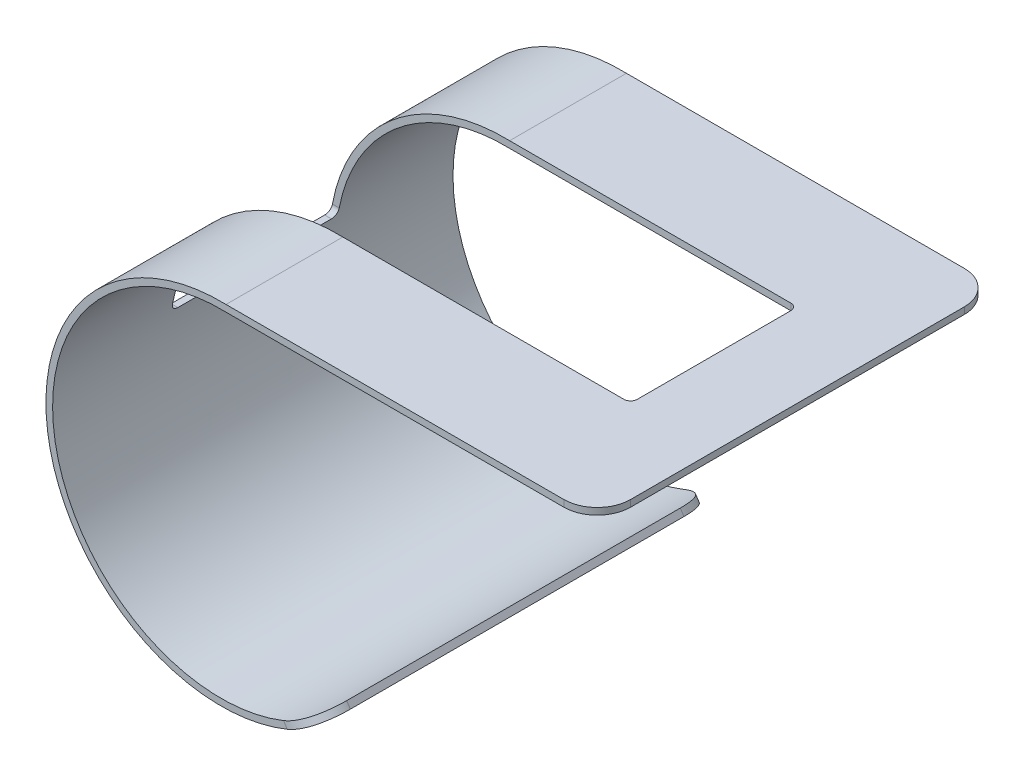
from build123d import *

# Parameters (mm, degrees)
EXTRUDE_THIN1_DEPTH = 76.2
FILLET1_R           = 12.7
SKETCH2_W           = 190.5
SKETCH2_H           = 63.5
CUT_EXTRUDE1_DEPTH  = 57.15
FILLET2_R           = 2.54


with BuildPart() as part:
    # Sketch1 → Extrude-Thin1 (new, symmetric)
    with BuildSketch(Plane.XY):
        with BuildLine():
            Line((134.168540946, 66.648854011), (-7.118959054, 66.648854011))
            ThreePointArc((-7.118959054, 66.648854011), (-73.147095727, -18.135899971), (27.495287719, -55.809232643))
            Line((27.495287719, -55.809232643), (26.105523948, -53.683166638))
            ThreePointArc((26.105523948, -53.683166638), (-70.707652233, -17.428059655), (-7.154874368, 64.108854011))
            Line((-7.154874368, 64.108854011), (134.168540946, 64.108854011))
            Line((134.168540946, 64.108854011), (134.168540946, 66.648854011))
        make_face()
    extrude(amount=EXTRUDE_THIN1_DEPTH, both=True)

    # Fillet1
    fillet1_edges = [part.edges().sort_by_distance(p)[0] for p in [
        (134.168540946, 65.378854011, 76.2),
        (134.168540946, 65.378854011, -76.2),
        (26.800405833, -54.74619964, -76.2),
        (26.800405833, -54.74619964, 76.2),
    ]]
    fillet(fillet1_edges, radius=FILLET1_R)

    # Sketch2 → Cut-Extrude1 (cut, symmetric)
    with BuildSketch(Plane(origin=(0, 66.648854011, 0), x_dir=(1, 0, 0), z_dir=(0, 1, 0))):
        with Locations((7.168540946, 0)):
            Rectangle(SKETCH2_W, SKETCH2_H)
    extrude(amount=CUT_EXTRUDE1_DEPTH, both=True, mode=Mode.SUBTRACT)

    # Fillet2
    fillet2_edges = [part.edges().sort_by_distance(p)[0] for p in [
        (102.418540946, 65.378854011, -31.75),
        (102.418540946, 65.378854011, 31.75),
        (-73.697301111, 9.498854011, 31.75),
        (-73.697301111, 9.498854011, -31.75),
    ]]
    fillet(fillet2_edges, radius=FILLET2_R)


solid = part.part
